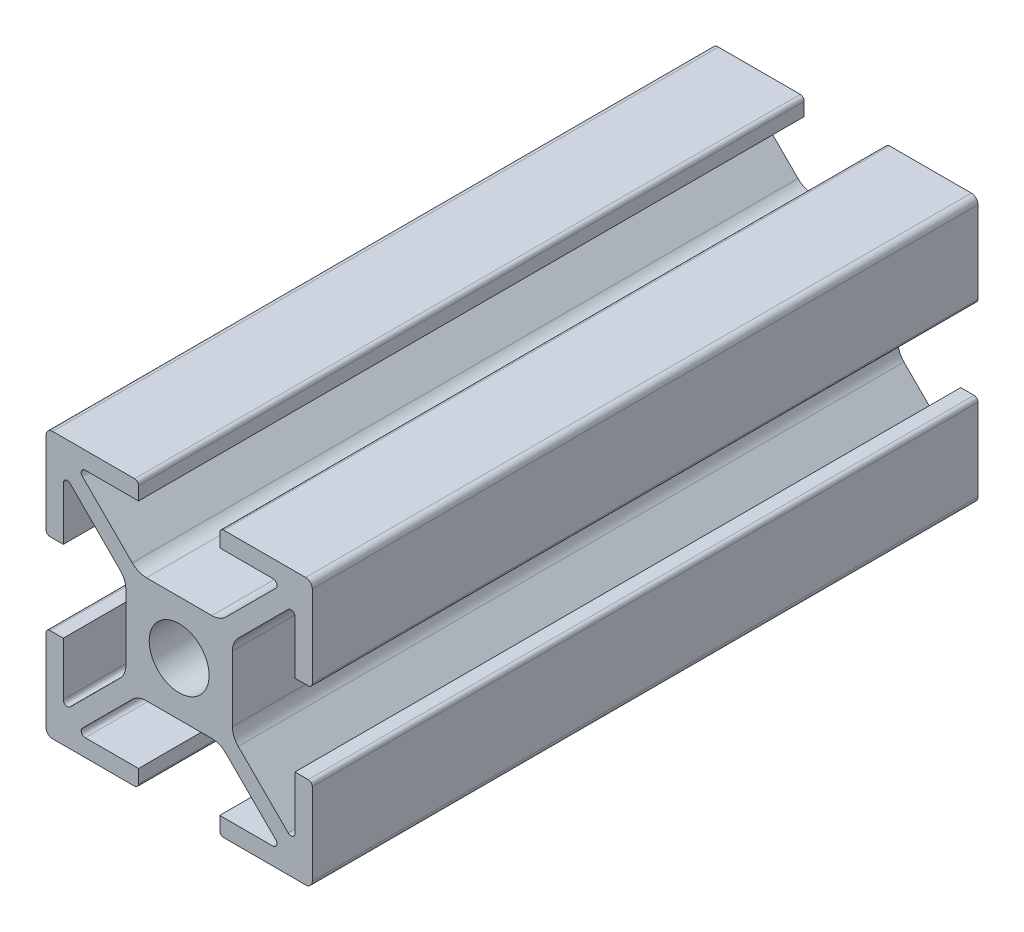
from build123d import *

# Parameters (mm, degrees)
ESBO_O11_R                                   = 2.25
QUADRADO_PF20_21_PERFIL_2020_T_SLOT_6M_DEPTH = 50


with BuildPart() as part:
    # Esboço11 → Quadrado PF20-21 - PERFIL 2020 T-SLOT 6MM(1) (new body)
    with BuildSketch(Plane(origin=(0, 0, 0), x_dir=(0, -1, 0), z_dir=(0, 0, 1))):
        with BuildLine():
            Line((8.187867966, -7.26862915), (4.439339828, -3.520101013))
            ThreePointArc((4.439339828, -3.520101013), (4.114180701, -3.033465989), (4, -2.459440841))
            Line((4, -2.459440841), (4, 2.459440841))
            ThreePointArc((4, 2.459440841), (4.114180701, 3.033465989), (4.439339828, 3.520101013))
            Line((4.439339828, 3.520101013), (8.187867966, 7.26862915))
            ThreePointArc((8.187867966, 7.26862915), (8.51480503, 7.333660975), (8.7, 7.056497116))
            Line((8.7, 7.056497116), (8.7, 3.05))
            Line((8.7, 3.05), (9.7, 3.05))
            ThreePointArc((9.7, 3.05), (9.912132034, 3.137867966), (10, 3.35))
            Line((10, 3.35), (10, 9.5))
            ThreePointArc((10, 9.5), (9.853553391, 9.853553391), (9.5, 10))
            Line((9.5, 10), (3.35, 10))
            ThreePointArc((3.35, 10), (3.137867966, 9.912132034), (3.05, 9.7))
            Line((3.05, 9.7), (3.05, 8.7))
            Line((3.05, 8.7), (7.056497116, 8.7))
            ThreePointArc((7.056497116, 8.7), (7.333660975, 8.51480503), (7.26862915, 8.187867966))
            Line((7.26862915, 8.187867966), (3.520101013, 4.439339828))
            ThreePointArc((3.520101013, 4.439339828), (3.033465989, 4.114180701), (2.459440841, 4))
            Line((2.459440841, 4), (-2.459440841, 4))
            ThreePointArc((-2.459440841, 4), (-3.033465989, 4.114180701), (-3.520101013, 4.439339828))
            Line((-3.520101013, 4.439339828), (-7.26862915, 8.187867966))
            ThreePointArc((-7.26862915, 8.187867966), (-7.333660975, 8.51480503), (-7.056497116, 8.7))
            Line((-7.056497116, 8.7), (-3.05, 8.7))
            Line((-3.05, 8.7), (-3.05, 9.7))
            ThreePointArc((-3.05, 9.7), (-3.137867966, 9.912132034), (-3.35, 10))
            Line((-3.35, 10), (-9.5, 10))
            ThreePointArc((-9.5, 10), (-9.853553391, 9.853553391), (-10, 9.5))
            Line((-10, 9.5), (-10, 3.35))
            ThreePointArc((-10, 3.35), (-9.912132034, 3.137867966), (-9.7, 3.05))
            Line((-9.7, 3.05), (-8.7, 3.05))
            Line((-8.7, 3.05), (-8.7, 7.056497116))
            ThreePointArc((-8.7, 7.056497116), (-8.51480503, 7.333660975), (-8.187867966, 7.26862915))
            Line((-8.187867966, 7.26862915), (-4.439339828, 3.520101013))
            ThreePointArc((-4.439339828, 3.520101013), (-4.114180701, 3.033465989), (-4, 2.459440841))
            Line((-4, 2.459440841), (-4, -2.459440841))
            ThreePointArc((-4, -2.459440841), (-4.114180701, -3.033465989), (-4.439339828, -3.520101013))
            Line((-4.439339828, -3.520101013), (-8.187867966, -7.26862915))
            ThreePointArc((-8.187867966, -7.26862915), (-8.51480503, -7.333660975), (-8.7, -7.056497116))
            Line((-8.7, -7.056497116), (-8.7, -3.05))
            Line((-8.7, -3.05), (-9.7, -3.05))
            ThreePointArc((-9.7, -3.05), (-9.912132034, -3.137867966), (-10, -3.35))
            Line((-10, -3.35), (-10, -9.5))
            ThreePointArc((-10, -9.5), (-9.853553391, -9.853553391), (-9.5, -10))
            Line((-9.5, -10), (-3.35, -10))
            ThreePointArc((-3.35, -10), (-3.137867966, -9.912132034), (-3.05, -9.7))
            Line((-3.05, -9.7), (-3.05, -8.7))
            Line((-3.05, -8.7), (-7.056497116, -8.7))
            ThreePointArc((-7.056497116, -8.7), (-7.333660975, -8.51480503), (-7.26862915, -8.187867966))
            Line((-7.26862915, -8.187867966), (-3.520101013, -4.439339828))
            ThreePointArc((-3.520101013, -4.439339828), (-3.033465989, -4.114180701), (-2.459440841, -4))
            Line((-2.459440841, -4), (2.459440841, -4))
            ThreePointArc((2.459440841, -4), (3.033465989, -4.114180701), (3.520101013, -4.439339828))
            Line((3.520101013, -4.439339828), (7.26862915, -8.187867966))
            ThreePointArc((7.26862915, -8.187867966), (7.333660975, -8.51480503), (7.056497116, -8.7))
            Line((7.056497116, -8.7), (3.05, -8.7))
            Line((3.05, -8.7), (3.05, -9.7))
            ThreePointArc((3.05, -9.7), (3.137867966, -9.912132034), (3.35, -10))
            Line((3.35, -10), (9.5, -10))
            ThreePointArc((9.5, -10), (9.853553391, -9.853553391), (10, -9.5))
            Line((10, -9.5), (10, -3.35))
            ThreePointArc((10, -3.35), (9.912132034, -3.137867966), (9.7, -3.05))
            Line((9.7, -3.05), (8.7, -3.05))
            Line((8.7, -3.05), (8.7, -7.056497116))
            ThreePointArc((8.7, -7.056497116), (8.51480503, -7.333660975), (8.187867966, -7.26862915))
        make_face()
        Circle(ESBO_O11_R, mode=Mode.SUBTRACT)
    extrude(amount=QUADRADO_PF20_21_PERFIL_2020_T_SLOT_6M_DEPTH)


solid = part.part
